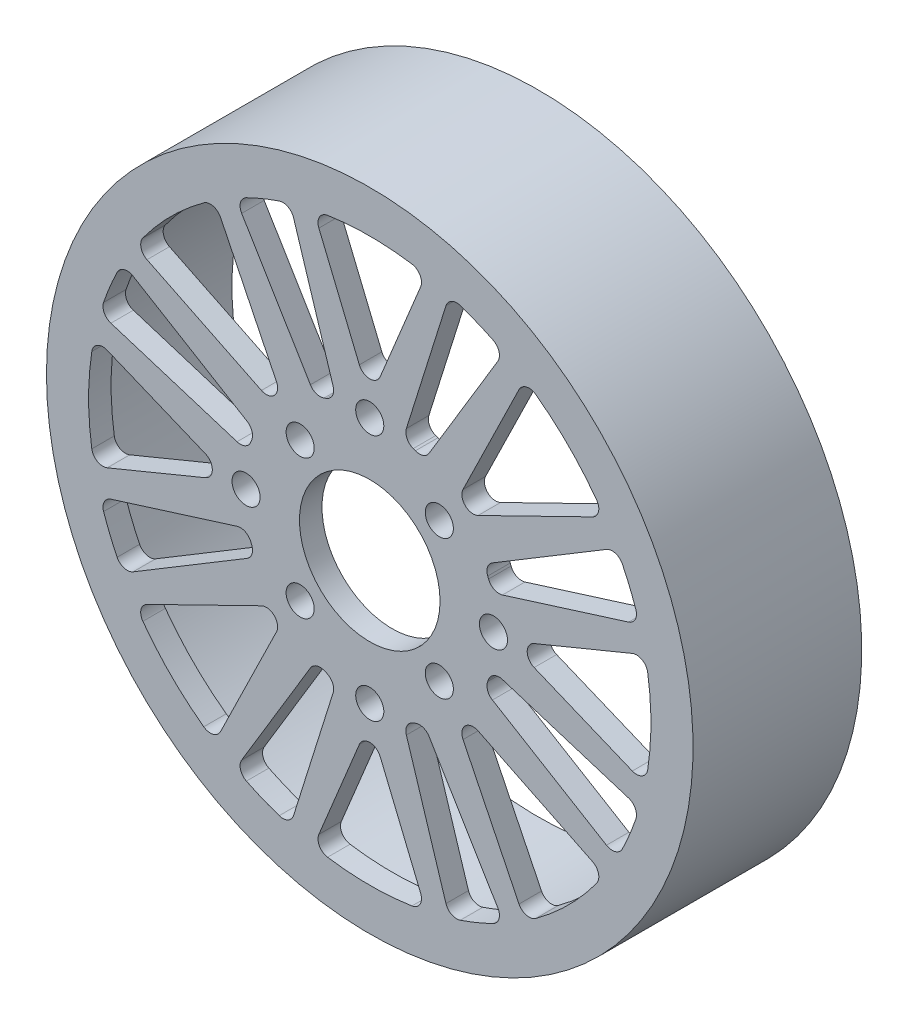
from build123d import *

# Parameters (mm, degrees)
SKETCH_1_R               = 67.5
EXTRUDE_1_DEPTH          = 4
SKETCH_2_R               = 2.5
CUT_EXTRUDE_1_DEPTH      = 96.543183954
PATTERN_CIRCULAR_1_COUNT = 4
SKETCH_3_R               = 12.5
CUT_EXTRUDE_2_DEPTH      = 96.543183954
EXTRUDE_START            = 26
SKETCH_4_R               = 67.5
SKETCH_4_R_2             = 54.5
EXTRUDE_2_DEPTH          = 26
SKETCH_5_R               = 67.5
SKETCH_5_R_2             = 57.5
CUT_EXTRUDE_3_DEPTH      = 101.062480481
CUT_EXTRUDE_4_DEPTH      = 87.674679117


with BuildPart() as part:
    # 草图1 → 凸台-拉伸1 (new body)
    with BuildSketch(Plane.XY):
        Circle(SKETCH_1_R)
    extrude(amount=EXTRUDE_1_DEPTH)

    # 草图2 → 切除-拉伸1 (cut, through all)
    with BuildSketch(Plane.XY.offset(4)):
        with Locations((0, 22)):
            Circle(SKETCH_2_R)
        with Locations((12.374368671, 12.374368671)):
            Circle(SKETCH_2_R)
    cut_extrude_1 = extrude(amount=-CUT_EXTRUDE_1_DEPTH, mode=Mode.SUBTRACT)

    # 阵列(圆周)1: 切除-拉伸1 ×4 about axis
    pattern_circular_1_axis = Axis((0, 0, 0), (0, 0, 1))
    for i in range(1, PATTERN_CIRCULAR_1_COUNT):
        add(cut_extrude_1.rotate(pattern_circular_1_axis, i * 360 / PATTERN_CIRCULAR_1_COUNT), mode=Mode.SUBTRACT)

    # 草图3 → 切除-拉伸2 (cut, through all)
    with BuildSketch(Plane.XY.offset(4)):
        Circle(SKETCH_3_R)
    extrude(amount=-CUT_EXTRUDE_2_DEPTH, mode=Mode.SUBTRACT)

    # 草图4 → 凸台-拉伸2 (add)
    with BuildSketch(Plane(origin=(0, 0, 0), x_dir=(-1, 0, 0), z_dir=(0, 0, -1)).offset(EXTRUDE_START)):
        with Locations(Location((0, 0, 0), (0, 0, 180))):
            Circle(SKETCH_4_R)
        with Locations(Location((0, 0, 0), (0, 0, 180))):
            Circle(SKETCH_4_R_2, mode=Mode.SUBTRACT)
    extrude(amount=-EXTRUDE_2_DEPTH)

    # 草图5 → 切除-拉伸3 (cut, through all)
    with BuildSketch(Plane(origin=(0, 0, -26), x_dir=(-1, 0, 0), z_dir=(0, 0, -1))):
        Circle(SKETCH_5_R)
        Circle(SKETCH_5_R_2, mode=Mode.SUBTRACT)
    extrude(amount=-CUT_EXTRUDE_3_DEPTH, mode=Mode.SUBTRACT)

    # 草图6 → 切除-拉伸4 (cut, through all)
    with BuildSketch(Plane.XY.offset(4)):
        with BuildLine():
            Line((-9.052385327, 46.693458718), (-1.848770467, 29.237079453))
            ThreePointArc((-1.848770467, 29.237079453), (0, 28), (1.848770467, 29.237079453))
            Line((1.848770467, 29.237079453), (9.052385327, 46.693458718))
            ThreePointArc((9.052385327, 46.693458718), (8.944802657, 48.440383868), (7.50376548, 49.433728401))
            ThreePointArc((7.50376548, 49.433728401), (0, 50), (-7.50376548, 49.433728401))
            ThreePointArc((-7.50376548, 49.433728401), (-8.944802657, 48.440383868), (-9.052385327, 46.693458718))
        make_face()
        with BuildLine():
            Line((-13.553167257, 46.040555084), (-6.512327159, 23.606368847))
            ThreePointArc((-6.512327159, 23.606368847), (-6.626606267, 22.123318115), (-7.733163126, 21.129320578))
            ThreePointArc((-7.733163126, 21.129320578), (-7.928204908, 21.056912569), (-8.122568831, 20.982704201))
            ThreePointArc((-8.122568831, 20.982704201), (-9.491921374, 20.955495595), (-10.557690017, 21.815730385))
            Line((-10.557690017, 21.815730385), (-22.7777165, 42.098890031))
            ThreePointArc((-22.7777165, 42.098890031), (-22.98272615, 43.69738305), (-21.942293158, 44.928117821))
            ThreePointArc((-21.942293158, 44.928117821), (-19.061985374, 46.223811111), (-16.105620314, 47.335071504))
            ThreePointArc((-16.105620314, 47.335071504), (-14.556757806, 47.225381244), (-13.553167257, 46.040555084))
        make_face()
        with BuildLine():
            Line((13.553167257, 46.040555084), (6.512327159, 23.606368847))
            ThreePointArc((6.512327159, 23.606368847), (6.626606267, 22.123318115), (7.733163126, 21.129320578))
            ThreePointArc((7.733163126, 21.129320578), (7.928204908, 21.056912569), (8.122568831, 20.982704201))
            ThreePointArc((8.122568831, 20.982704201), (9.491921374, 20.955495595), (10.557690017, 21.815730385))
            Line((10.557690017, 21.815730385), (22.7777165, 42.098890031))
            ThreePointArc((22.7777165, 42.098890031), (22.98272615, 43.69738305), (21.942293158, 44.928117821))
            ThreePointArc((21.942293158, 44.928117821), (19.061985374, 46.223811111), (16.105620314, 47.335071504))
            ThreePointArc((16.105620314, 47.335071504), (14.556757806, 47.225381244), (13.553167257, 46.040555084))
        make_face()
        with BuildLine():
            Line((46.693458718, 9.052385327), (29.237079453, 1.848770467))
            ThreePointArc((29.237079453, 1.848770467), (28, 0), (29.237079453, -1.848770467))
            Line((29.237079453, -1.848770467), (46.693458718, -9.052385327))
            ThreePointArc((46.693458718, -9.052385327), (48.440383868, -8.944802657), (49.433728401, -7.50376548))
            ThreePointArc((49.433728401, -7.50376548), (50, 0), (49.433728401, 7.50376548))
            ThreePointArc((49.433728401, 7.50376548), (48.440383868, 8.944802657), (46.693458718, 9.052385327))
        make_face()
        with BuildLine():
            Line((46.040555084, -13.553167257), (23.606368847, -6.512327159))
            ThreePointArc((23.606368847, -6.512327159), (22.123318115, -6.626606267), (21.129320578, -7.733163126))
            ThreePointArc((21.129320578, -7.733163126), (21.056912569, -7.928204908), (20.982704201, -8.122568831))
            ThreePointArc((20.982704201, -8.122568831), (20.955495595, -9.491921374), (21.815730385, -10.557690017))
            Line((21.815730385, -10.557690017), (42.098890031, -22.7777165))
            ThreePointArc((42.098890031, -22.7777165), (43.69738305, -22.98272615), (44.928117821, -21.942293158))
            ThreePointArc((44.928117821, -21.942293158), (46.223811111, -19.061985374), (47.335071504, -16.105620314))
            ThreePointArc((47.335071504, -16.105620314), (47.225381244, -14.556757806), (46.040555084, -13.553167257))
        make_face()
        with BuildLine():
            Line((46.040555084, 13.553167257), (23.606368847, 6.512327159))
            ThreePointArc((23.606368847, 6.512327159), (22.123318115, 6.626606267), (21.129320578, 7.733163126))
            ThreePointArc((21.129320578, 7.733163126), (21.056912569, 7.928204908), (20.982704201, 8.122568831))
            ThreePointArc((20.982704201, 8.122568831), (20.955495595, 9.491921374), (21.815730385, 10.557690017))
            Line((21.815730385, 10.557690017), (42.098890031, 22.7777165))
            ThreePointArc((42.098890031, 22.7777165), (43.69738305, 22.98272615), (44.928117821, 21.942293158))
            ThreePointArc((44.928117821, 21.942293158), (46.223811111, 19.061985374), (47.335071504, 16.105620314))
            ThreePointArc((47.335071504, 16.105620314), (47.225381244, 14.556757806), (46.040555084, 13.553167257))
        make_face()
        with BuildLine():
            Line((9.052385327, -46.693458718), (1.848770467, -29.237079453))
            ThreePointArc((1.848770467, -29.237079453), (0, -28), (-1.848770467, -29.237079453))
            Line((-1.848770467, -29.237079453), (-9.052385327, -46.693458718))
            ThreePointArc((-9.052385327, -46.693458718), (-8.944802657, -48.440383868), (-7.50376548, -49.433728401))
            ThreePointArc((-7.50376548, -49.433728401), (0, -50), (7.50376548, -49.433728401))
            ThreePointArc((7.50376548, -49.433728401), (8.944802657, -48.440383868), (9.052385327, -46.693458718))
        make_face()
        with BuildLine():
            Line((-13.553167257, -46.040555084), (-6.512327159, -23.606368847))
            ThreePointArc((-6.512327159, -23.606368847), (-6.626606267, -22.123318115), (-7.733163126, -21.129320578))
            ThreePointArc((-7.733163126, -21.129320578), (-7.928204908, -21.056912569), (-8.122568831, -20.982704201))
            ThreePointArc((-8.122568831, -20.982704201), (-9.491921374, -20.955495595), (-10.557690017, -21.815730385))
            Line((-10.557690017, -21.815730385), (-22.7777165, -42.098890031))
            ThreePointArc((-22.7777165, -42.098890031), (-22.98272615, -43.69738305), (-21.942293158, -44.928117821))
            ThreePointArc((-21.942293158, -44.928117821), (-19.061985374, -46.223811111), (-16.105620314, -47.335071504))
            ThreePointArc((-16.105620314, -47.335071504), (-14.556757806, -47.225381244), (-13.553167257, -46.040555084))
        make_face()
        with BuildLine():
            Line((13.553167257, -46.040555084), (6.512327159, -23.606368847))
            ThreePointArc((6.512327159, -23.606368847), (6.626606267, -22.123318115), (7.733163126, -21.129320578))
            ThreePointArc((7.733163126, -21.129320578), (7.928204908, -21.056912569), (8.122568831, -20.982704201))
            ThreePointArc((8.122568831, -20.982704201), (9.491921374, -20.955495595), (10.557690017, -21.815730385))
            Line((10.557690017, -21.815730385), (22.7777165, -42.098890031))
            ThreePointArc((22.7777165, -42.098890031), (22.98272615, -43.69738305), (21.942293158, -44.928117821))
            ThreePointArc((21.942293158, -44.928117821), (19.061985374, -46.223811111), (16.105620314, -47.335071504))
            ThreePointArc((16.105620314, -47.335071504), (14.556757806, -47.225381244), (13.553167257, -46.040555084))
        make_face()
        with BuildLine():
            Line((-46.693458718, -9.052385327), (-29.237079453, -1.848770467))
            ThreePointArc((-29.237079453, -1.848770467), (-28, 0), (-29.237079453, 1.848770467))
            Line((-29.237079453, 1.848770467), (-46.693458718, 9.052385327))
            ThreePointArc((-46.693458718, 9.052385327), (-48.440383868, 8.944802657), (-49.433728401, 7.50376548))
            ThreePointArc((-49.433728401, 7.50376548), (-50, 0), (-49.433728401, -7.50376548))
            ThreePointArc((-49.433728401, -7.50376548), (-48.440383868, -8.944802657), (-46.693458718, -9.052385327))
        make_face()
        with BuildLine():
            Line((-46.040555084, 13.553167257), (-23.606368847, 6.512327159))
            ThreePointArc((-23.606368847, 6.512327159), (-22.123318115, 6.626606267), (-21.129320578, 7.733163126))
            ThreePointArc((-21.129320578, 7.733163126), (-21.056912569, 7.928204908), (-20.982704201, 8.122568831))
            ThreePointArc((-20.982704201, 8.122568831), (-20.955495595, 9.491921374), (-21.815730385, 10.557690017))
            Line((-21.815730385, 10.557690017), (-42.098890031, 22.7777165))
            ThreePointArc((-42.098890031, 22.7777165), (-43.69738305, 22.98272615), (-44.928117821, 21.942293158))
            ThreePointArc((-44.928117821, 21.942293158), (-46.223811111, 19.061985374), (-47.335071504, 16.105620314))
            ThreePointArc((-47.335071504, 16.105620314), (-47.225381244, 14.556757806), (-46.040555084, 13.553167257))
        make_face()
        with BuildLine():
            Line((-46.040555084, -13.553167257), (-23.606368847, -6.512327159))
            ThreePointArc((-23.606368847, -6.512327159), (-22.123318115, -6.626606267), (-21.129320578, -7.733163126))
            ThreePointArc((-21.129320578, -7.733163126), (-21.056912569, -7.928204908), (-20.982704201, -8.122568831))
            ThreePointArc((-20.982704201, -8.122568831), (-20.955495595, -9.491921374), (-21.815730385, -10.557690017))
            Line((-21.815730385, -10.557690017), (-42.098890031, -22.7777165))
            ThreePointArc((-42.098890031, -22.7777165), (-43.69738305, -22.98272615), (-44.928117821, -21.942293158))
            ThreePointArc((-44.928117821, -21.942293158), (-46.223811111, -19.061985374), (-47.335071504, -16.105620314))
            ThreePointArc((-47.335071504, -16.105620314), (-47.225381244, -14.556757806), (-46.040555084, -13.553167257))
        make_face()
        with BuildLine():
            Line((-16.588226452, 19.263644109), (-26.545556797, 39.618059714))
            ThreePointArc((-26.545556797, 39.618059714), (-27.862624209, 40.680865571), (-29.523027766, 40.353324913))
            ThreePointArc((-29.523027766, 40.353324913), (-35.355339059, 35.355339059), (-40.353324913, 29.523027766))
            ThreePointArc((-40.353324913, 29.523027766), (-40.680865571, 27.862624209), (-39.618059714, 26.545556797))
            Line((-39.618059714, 26.545556797), (-19.263644109, 16.588226452))
            ThreePointArc((-19.263644109, 16.588226452), (-16.970562748, 16.970562748), (-16.588226452, 19.263644109))
        make_face()
        with BuildLine():
            Line((19.263644109, 16.588226452), (39.618059714, 26.545556797))
            ThreePointArc((39.618059714, 26.545556797), (40.680865571, 27.862624209), (40.353324913, 29.523027766))
            ThreePointArc((40.353324913, 29.523027766), (35.355339059, 35.355339059), (29.523027766, 40.353324913))
            ThreePointArc((29.523027766, 40.353324913), (27.862624209, 40.680865571), (26.545556797, 39.618059714))
            Line((26.545556797, 39.618059714), (16.588226452, 19.263644109))
            ThreePointArc((16.588226452, 19.263644109), (16.970562748, 16.970562748), (19.263644109, 16.588226452))
        make_face()
        with BuildLine():
            Line((16.588226452, -19.263644109), (26.545556797, -39.618059714))
            ThreePointArc((26.545556797, -39.618059714), (27.862624209, -40.680865571), (29.523027766, -40.353324913))
            ThreePointArc((29.523027766, -40.353324913), (35.355339059, -35.355339059), (40.353324913, -29.523027766))
            ThreePointArc((40.353324913, -29.523027766), (40.680865571, -27.862624209), (39.618059714, -26.545556797))
            Line((39.618059714, -26.545556797), (19.263644109, -16.588226452))
            ThreePointArc((19.263644109, -16.588226452), (16.970562748, -16.970562748), (16.588226452, -19.263644109))
        make_face()
        with BuildLine():
            Line((-19.263644109, -16.588226452), (-39.618059714, -26.545556797))
            ThreePointArc((-39.618059714, -26.545556797), (-40.680865571, -27.862624209), (-40.353324913, -29.523027766))
            ThreePointArc((-40.353324913, -29.523027766), (-35.355339059, -35.355339059), (-29.523027766, -40.353324913))
            ThreePointArc((-29.523027766, -40.353324913), (-27.862624209, -40.680865571), (-26.545556797, -39.618059714))
            Line((-26.545556797, -39.618059714), (-16.588226452, -19.263644109))
            ThreePointArc((-16.588226452, -19.263644109), (-16.970562748, -16.970562748), (-19.263644109, -16.588226452))
        make_face()
    extrude(amount=-CUT_EXTRUDE_4_DEPTH, mode=Mode.SUBTRACT)


solid = part.part
